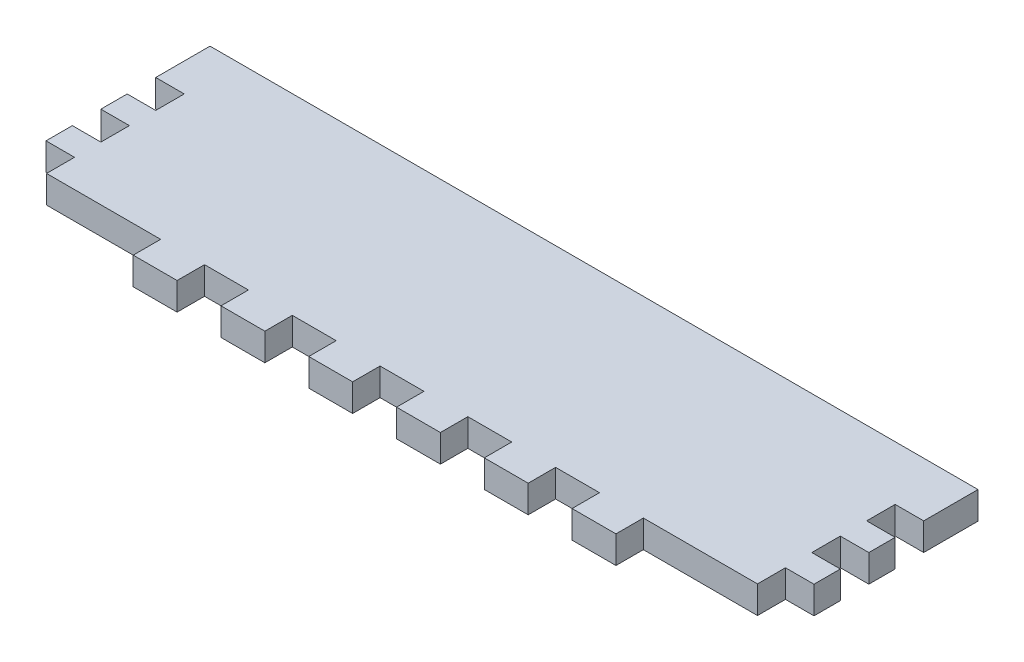
from build123d import *

# Parameters (mm, degrees)
SKETCH1_W           = 88.9
SKETCH1_H           = 19.05
BOSS_EXTRUDE1_DEPTH = 3.175
SKETCH2_W           = 3.302
SKETCH2_H           = 3.302
CUT_EXTRUDE1_DEPTH  = 46.5698228
SKETCH3_W           = 5.08
SKETCH3_H           = 3.175
SKETCH3_W_2         = 88.9
BOSS_EXTRUDE2_DEPTH = 3.175


with BuildPart() as part:
    # Sketch1 → Boss-Extrude1 (new body)
    with BuildSketch(Plane(origin=(0, 0, 0), x_dir=(1, 0, 0), z_dir=(0, 1, 0))):
        Rectangle(SKETCH1_W, SKETCH1_H)
    extrude(amount=BOSS_EXTRUDE1_DEPTH)

    # Sketch2 → Cut-Extrude1 (cut, through all)
    with BuildSketch(Plane(origin=(0, 3.175, 0), x_dir=(1, 0, 0), z_dir=(0, 1, 0))):
        with Locations((-42.799, 4.7625)):
            Rectangle(SKETCH2_W, SKETCH2_H)
        with Locations((-42.799, -1.5875)):
            Rectangle(SKETCH2_W, SKETCH2_H)
        with Locations((-42.799, -7.9375)):
            Rectangle(SKETCH2_W, SKETCH2_H)
        with Locations((42.799, -7.9375)):
            Rectangle(SKETCH2_W, SKETCH2_H)
        with Locations((42.799, -1.5875)):
            Rectangle(SKETCH2_W, SKETCH2_H)
        with Locations((42.799, 4.7625)):
            Rectangle(SKETCH2_W, SKETCH2_H)
    extrude(amount=-CUT_EXTRUDE1_DEPTH, mode=Mode.SUBTRACT)

    # Sketch3 → Boss-Extrude2 (add)
    with BuildSketch(Plane(origin=(0, 0, 0), x_dir=(1, 0, 0), z_dir=(0, 1, 0))):
        with Locations((-25.4, -11.1125)):
            Rectangle(SKETCH3_W, SKETCH3_H)
        with Locations((-15.24, -11.1125)):
            Rectangle(SKETCH3_W, SKETCH3_H)
        with Locations((0, 11.1125)):
            Rectangle(SKETCH3_W_2, SKETCH3_H)
        with Locations((-5.08, -11.1125)):
            Rectangle(SKETCH3_W, SKETCH3_H)
        with Locations((5.08, -11.1125)):
            Rectangle(SKETCH3_W, SKETCH3_H)
        with Locations((15.24, -11.1125)):
            Rectangle(SKETCH3_W, SKETCH3_H)
        with Locations((25.4, -11.1125)):
            Rectangle(SKETCH3_W, SKETCH3_H)
    extrude(amount=BOSS_EXTRUDE2_DEPTH)


solid = part.part
